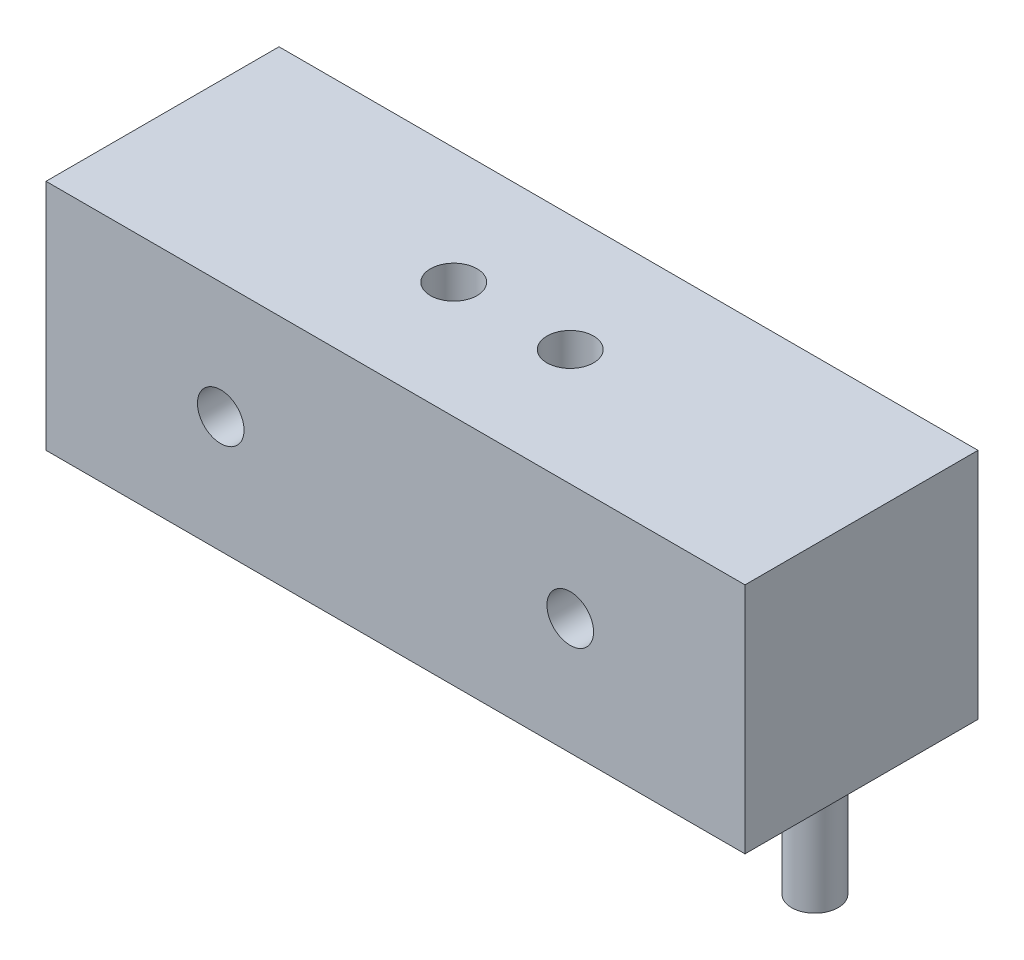
from build123d import *

# Parameters (mm, degrees)
SKETCH1_W           = 30
SKETCH1_H           = 10
BOSS_EXTRUDE1_DEPTH = 10
SKETCH2_R           = 1
CUT_EXTRUDE1_DEPTH  = 19.708286934
SKETCH4_R           = 1
CUT_EXTRUDE3_DEPTH  = 21.615528128
SKETCH3_R           = 1
BOSS_EXTRUDE2_DEPTH = 5


with BuildPart() as part:
    # Sketch1 → Boss-Extrude1 (new body)
    with BuildSketch(Plane.XY):
        Rectangle(SKETCH1_W, SKETCH1_H)
    extrude(amount=BOSS_EXTRUDE1_DEPTH)

    # Sketch2 → Cut-Extrude1 (cut, through all)
    with BuildSketch(Plane.XY.offset(10)):
        with Locations((-7.5, 0)):
            Circle(SKETCH2_R)
        with Locations((7.5, 0)):
            Circle(SKETCH2_R)
    extrude(amount=-CUT_EXTRUDE1_DEPTH, mode=Mode.SUBTRACT)

    # Sketch4 → Cut-Extrude3 (cut, through all)
    with BuildSketch(Plane(origin=(0, 5, 0), x_dir=(1, 0, 0), z_dir=(0, 1, 0))):
        with Locations(Location((-2.5, -5, 0), (0, 0, 270))):
            Circle(SKETCH4_R)
        with Locations(Location((2.5, -5, 0), (0, 0, 270))):
            Circle(SKETCH4_R)
    extrude(amount=-CUT_EXTRUDE3_DEPTH, mode=Mode.SUBTRACT)

    # Sketch3 → Boss-Extrude2 (add)
    with BuildSketch(Plane.XZ.offset(5)):
        with Locations(Location((13, 5, 0), (0, 0, 90))):
            Circle(SKETCH3_R)
    extrude(amount=BOSS_EXTRUDE2_DEPTH)


solid = part.part
